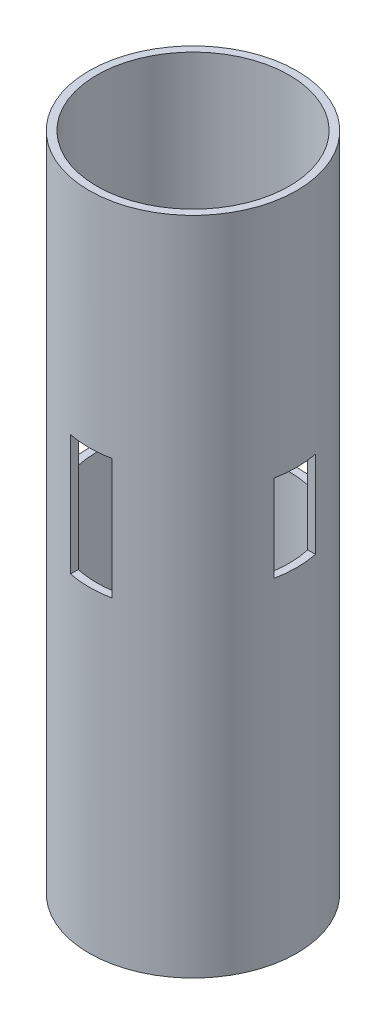
from build123d import *

# Parameters (mm, degrees)
SKETCH1_R               = 27.5
SKETCH1_R_2             = 25.5
BOSS_EXTRUDE1_DEPTH     = 175
CUT_EXTRUDE1_DEPTH      = 180.26935042
CUT_EXTRUDE1_DEPTH_BACK = 180.26935042
SKETCH3_W               = 11
SKETCH3_H               = 23
CUT_EXTRUDE2_DEPTH      = 180.26935042
CUT_EXTRUDE2_DEPTH_BACK = 180.26935042
SKETCH4_W               = 11
SKETCH4_H               = 32


with BuildPart() as part:
    # Sketch1 → Boss-Extrude1 (new body)
    with BuildSketch(Plane(origin=(0, 0, 0), x_dir=(1, 0, 0), z_dir=(0, 1, 0))):
        with Locations(Location((0, 0, 0), (0, 0, 270))):
            Circle(SKETCH1_R)
        with Locations(Location((0, 0, 0), (0, 0, 270))):
            Circle(SKETCH1_R_2, mode=Mode.SUBTRACT)
    extrude(amount=BOSS_EXTRUDE1_DEPTH)

    # Sketch3 → Cut-Extrude1 (cut, two sides: drawn at the far end of the back side and taken through both)
    with BuildSketch(Plane(origin=(0, 0, 0), x_dir=(0, 0, -1), z_dir=(1, 0, 0)).offset(-CUT_EXTRUDE1_DEPTH_BACK)):
        with Locations((0, 100)):
            Rectangle(SKETCH3_W, SKETCH3_H)
    extrude(amount=CUT_EXTRUDE1_DEPTH + CUT_EXTRUDE1_DEPTH_BACK, mode=Mode.SUBTRACT)

    # Sketch4 → Cut-Extrude2 (cut, two sides: drawn at the far end of the back side and taken through both)
    with BuildSketch(Plane.XY.offset(-CUT_EXTRUDE2_DEPTH_BACK)):
        with Locations((0, 100)):
            Rectangle(SKETCH4_W, SKETCH4_H)
    extrude(amount=CUT_EXTRUDE2_DEPTH + CUT_EXTRUDE2_DEPTH_BACK, mode=Mode.SUBTRACT)


solid = part.part
